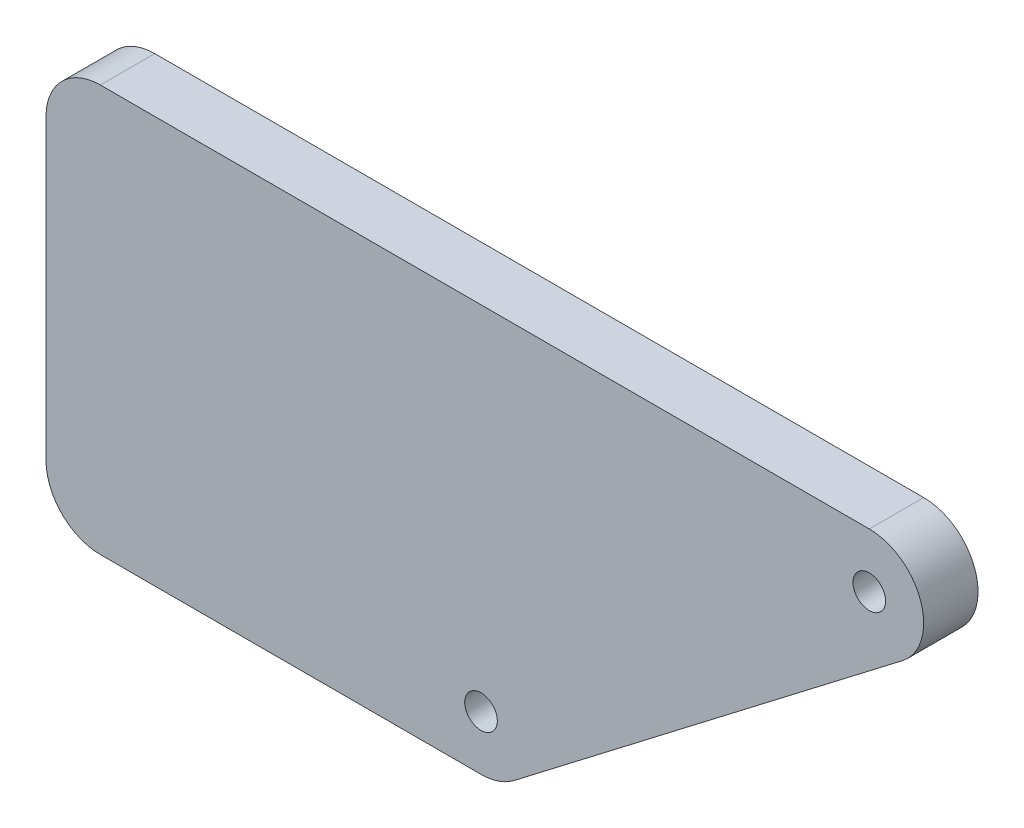
from build123d import *

# Parameters (mm, degrees)
SKETCH2_R      = 10
SKETCH2_R_2    = 3
EXTRUDE1_DEPTH = 10


with BuildPart() as part:
    # Sketch2 → Extrude1 (new body)
    # profile 1 of 5: a face of its own
    with BuildSketch(Plane.XY):
        with BuildLine():
            Line((71.401800626, 64.788528611), (-70, 64.788528611))
            ThreePointArc((-70, 64.788528611), (-62.928932188, 61.859596423), (-60, 54.788528611))
            ThreePointArc((-60, 54.788528611), (-70, 44.788528611), (-80, 54.788528611))
            Line((-80, 54.788528611), (-80, 0))
            ThreePointArc((-80, 0), (-70, 10), (-60, 0))
            ThreePointArc((-60, 0), (-62.928932188, -7.071067812), (-70, -10))
            Line((-70, -10), (0, -10))
            ThreePointArc((0, -10), (-7.071067812, 7.071067812), (10, 0))
            ThreePointArc((10, 0), (8.968727415, -4.422886902), (6.08761429, -7.933533403))
            Line((6.08761429, -7.933533403), (77.489414916, 46.854995208))
            ThreePointArc((77.489414916, 46.854995208), (61.932499331, 51.574133958), (71.401800626, 64.788528611))
        make_face()
    # profile 2 of 5: a face of its own
    with BuildSketch(Plane.XY):
        Circle(SKETCH2_R)
        Circle(SKETCH2_R_2, mode=Mode.SUBTRACT)
    # profile 3 of 5: a face of its own
    with BuildSketch(Plane.XY):
        with Locations((-70, 0)):
            Circle(SKETCH2_R)
    # profile 4 of 5: a face of its own
    with BuildSketch(Plane.XY):
        with Locations((-70, 54.788528611)):
            Circle(SKETCH2_R)
    # profile 5 of 5: a face of its own
    with BuildSketch(Plane.XY):
        with Locations((71.401800626, 54.788528611)):
            Circle(SKETCH2_R)
        with Locations((71.401800626, 54.788528611)):
            Circle(SKETCH2_R_2, mode=Mode.SUBTRACT)
    extrude(amount=EXTRUDE1_DEPTH)


solid = part.part
